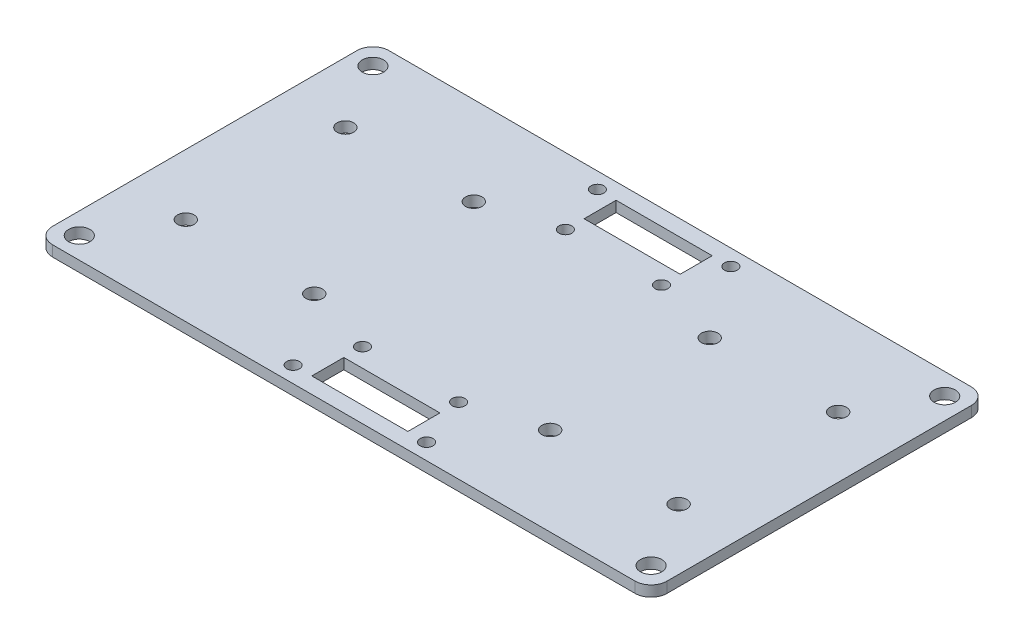
from build123d import *

# Parameters (mm, degrees)
ESBO_O1_W                = 115.09677689
ESBO_O1_H                = 63
RESSALTO_EXTRUS_O1_DEPTH = 2
ESBO_O2_R                = 1.55
CORTE_EXTRUS_O1_DEPTH    = 66.635866816
ESBO_O3_W                = 18
ESBO_O3_H                = 6
CORTE_EXTRUS_O2_DEPTH    = 66.635866816
ESBO_O5_R                = 2
CORTE_EXTRUS_O3_DEPTH    = 66.635866816
FILETE1_R                = 3
ESBO_O8_R                = 1.2
CORTE_EXTRUS_O4_DEPTH    = 66.635866816


with BuildPart() as part:
    # Esboço1 → Ressalto-extrusão1 (new body)
    with BuildSketch(Plane(origin=(0, 0, 0), x_dir=(1, 0, 0), z_dir=(0, 1, 0))):
        Rectangle(ESBO_O1_W, ESBO_O1_H)
    extrude(amount=RESSALTO_EXTRUS_O1_DEPTH)

    # Esboço2 → Corte-extrusão1 (cut, through all)
    with BuildSketch(Plane(origin=(0, 2, 0), x_dir=(1, 0, 0), z_dir=(0, 1, 0))):
        with Locations(Location((-46.153556516, -14.945, 0), (0, 0, 270))):
            Circle(ESBO_O2_R)
        with Locations(Location((-22.093556516, -14.94, 0), (0, 0, 270))):
            Circle(ESBO_O2_R)
        with Locations(Location((22.093556516, -14.94, 0), (0, 0, 90))):
            Circle(ESBO_O2_R)
        with Locations(Location((46.153556516, -14.945, 0), (0, 0, 90))):
            Circle(ESBO_O2_R)
        with Locations(Location((46.153556516, 14.945, 0), (0, 0, 270))):
            Circle(ESBO_O2_R)
        with Locations(Location((22.093556516, 14.94, 0), (0, 0, 270))):
            Circle(ESBO_O2_R)
        with Locations(Location((-22.093556516, 14.94, 0), (0, 0, 90))):
            Circle(ESBO_O2_R)
        with Locations(Location((-46.153556516, 14.945, 0), (0, 0, 90))):
            Circle(ESBO_O2_R)
    extrude(amount=-CORTE_EXTRUS_O1_DEPTH, mode=Mode.SUBTRACT)

    # Esboço3 → Corte-extrusão2 (cut, through all)
    with BuildSketch(Plane.XZ):
        with Locations((0, 25.5)):
            Rectangle(ESBO_O3_W, ESBO_O3_H)
        with Locations((0, -25.5)):
            Rectangle(ESBO_O3_W, ESBO_O3_H)
    extrude(amount=-CORTE_EXTRUS_O2_DEPTH, mode=Mode.SUBTRACT)

    # Esboço5 → Corte-extrusão3 (cut, through all)
    with BuildSketch(Plane(origin=(0, 2, 0), x_dir=(1, 0, 0), z_dir=(0, 1, 0))):
        with Locations(Location((53.548388445, 27.5, 0), (0, 0, 270))):
            Circle(ESBO_O5_R)
        with Locations(Location((53.548388445, -27.5, 0), (0, 0, 90))):
            Circle(ESBO_O5_R)
        with Locations(Location((-53.548388445, -27.5, 0), (0, 0, 270))):
            Circle(ESBO_O5_R)
        with Locations(Location((-53.548388445, 27.5, 0), (0, 0, 90))):
            Circle(ESBO_O5_R)
    extrude(amount=-CORTE_EXTRUS_O3_DEPTH, mode=Mode.SUBTRACT)

    # Filete1
    filete1_edges = [part.edges().sort_by_distance(p)[0] for p in [
        (-57.548388445, 1, -31.5),
        (57.548388445, 1, -31.5),
        (57.548388445, 1, 31.5),
        (-57.548388445, 1, 31.5),
    ]]
    fillet(filete1_edges, radius=FILETE1_R)

    # Esboço8 → Corte-extrusão4 (cut, through all)
    with BuildSketch(Plane(origin=(0, 2, 0), x_dir=(1, 0, 0), z_dir=(0, 1, 0))):
        with Locations(Location((-12.498388445, 28.5, 0), (0, 0, 270))):
            Circle(ESBO_O8_R)
        with Locations(Location((12.498388445, 28.5, 0), (0, 0, 90))):
            Circle(ESBO_O8_R)
        with Locations(Location((12.498388445, -28.5, 0), (0, 0, 270))):
            Circle(ESBO_O8_R)
        with Locations(Location((-12.498388445, -28.5, 0), (0, 0, 90))):
            Circle(ESBO_O8_R)
        with Locations(Location((-8.998388445, -19, 0), (0, 0, 270))):
            Circle(ESBO_O8_R)
        with Locations(Location((8.998388445, -19, 0), (0, 0, 90))):
            Circle(ESBO_O8_R)
        with Locations(Location((8.998388445, 19, 0), (0, 0, 270))):
            Circle(ESBO_O8_R)
        with Locations(Location((-8.998388445, 19, 0), (0, 0, 90))):
            Circle(ESBO_O8_R)
    extrude(amount=-CORTE_EXTRUS_O4_DEPTH, mode=Mode.SUBTRACT)


solid = part.part
